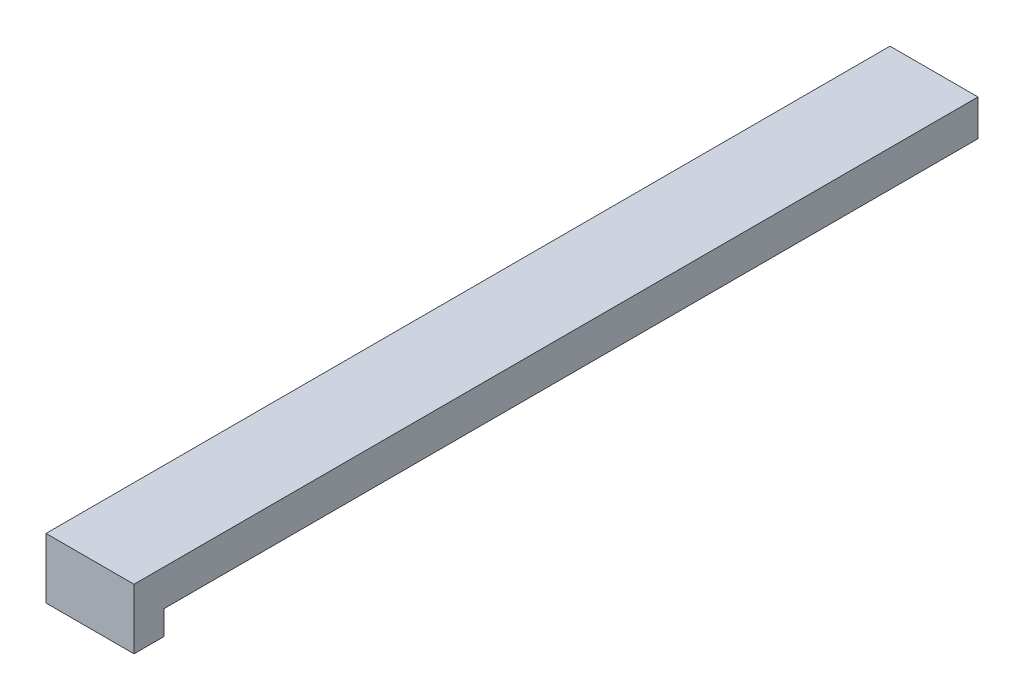
from build123d import *

# Parameters (mm, degrees)
BOSS_EXTRU_4_DEPTH = 140
BOSS_EXTRU_5_REACH = 142.319
ESQUISSE2_W        = 14.6
ESQUISSE2_H        = 5
ESQUISSE4_W        = 14.6
ESQUISSE4_H        = 5
BOSS_EXTRU_6_DEPTH = 10


with BuildPart() as part:
    # Esquisse1 → Boss.-Extru.4 (new body)
    with BuildSketch(Plane.XY):
        Polygon((-7.3, 0), (-7.3, -6), (-4.3, -6), (-4.3, -2), (4.3, -2), (4.3, -6), (7.3, -6), (7.3, 0), align=None)
    extrude(amount=BOSS_EXTRU_4_DEPTH)

    # Esquisse2 → Boss.-Extru.5 (add, up to next)
    with BuildSketch(Plane.XZ.offset(6), mode=Mode.PRIVATE) as boss_extru_5_sk1:
        with Locations((0, 2.5)):
            Rectangle(ESQUISSE2_W, ESQUISSE2_H)
    boss_extru_5_tool1 = extrude(boss_extru_5_sk1.sketch, amount=-BOSS_EXTRU_5_REACH, mode=Mode.PRIVATE) - part.part
    add(boss_extru_5_tool1.solids().sort_by_distance((0, -6, 2.5))[0])

    # Esquisse4 → Boss.-Extru.6 (add)
    with BuildSketch(Plane(origin=(0, 0, 0), x_dir=(1, 0, 0), z_dir=(0, 1, 0))):
        with Locations((0, -137.5)):
            Rectangle(ESQUISSE4_W, ESQUISSE4_H)
    extrude(amount=-BOSS_EXTRU_6_DEPTH)


solid = part.part
